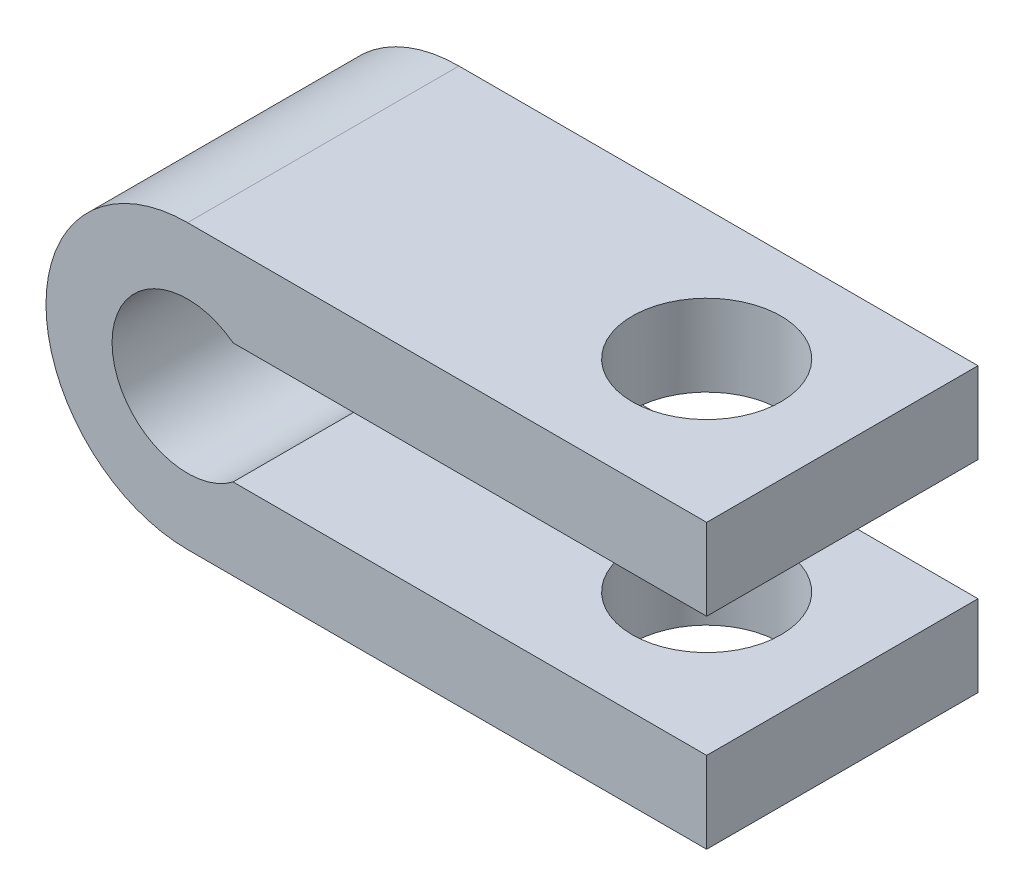
from build123d import *

# Parameters (mm, degrees)
BOSS_EXTRUDE1_DEPTH     = 12
CUT_EXTRUDE1_DEPTH      = 26.768197453
CUT_EXTRUDE1_DEPTH_BACK = 26.768197453
SKETCH2_R               = 3.15
CHAMFER1_SIZE           = 0.5


with BuildPart() as part:
    # Sketch1 → Boss-Extrude1 (new body)
    with BuildSketch(Plane.XY):
        with BuildLine():
            Line((0, 6), (22, 6))
            Line((22, 6), (22, 2.552710574))
            Line((22, 2.552710574), (1.929680991, 2.552710574))
            ThreePointArc((1.929680991, 2.552710574), (-3.2, 0), (1.929680991, -2.552710574))
            Line((1.929680991, -2.552710574), (22, -2.552710574))
            Line((22, -2.552710574), (22, -6))
            Line((22, -6), (0, -6))
            ThreePointArc((0, -6), (-6, 0), (0, 6))
        make_face()
    extrude(amount=BOSS_EXTRUDE1_DEPTH)

    # Sketch2 → Cut-Extrude1 (cut, two sides: drawn at the far end of the back side and taken through both)
    with BuildSketch(Plane(origin=(0, 0, 0), x_dir=(1, 0, 0), z_dir=(0, 1, 0)).offset(-CUT_EXTRUDE1_DEPTH_BACK)):
        with Locations(Location((16, -6, 0), (0, 0, 270))):
            Circle(SKETCH2_R)
    extrude(amount=CUT_EXTRUDE1_DEPTH + CUT_EXTRUDE1_DEPTH_BACK, mode=Mode.SUBTRACT)

    # Chamfer1
    chamfer1_edges = [part.edges().sort_by_distance(p)[0] for p in [
        (11.964840496, 2.552710574, 0),
        (-3.2, 0, 0),
        (11.964840496, -2.552710574, 0),
        (22, -4.276355287, 0),
        (11, -6, 0),
        (-6, 0, 0),
        (11, 6, 0),
        (22, 4.276355287, 0),
    ]]
    chamfer(chamfer1_edges, length=CHAMFER1_SIZE)


solid = part.part
